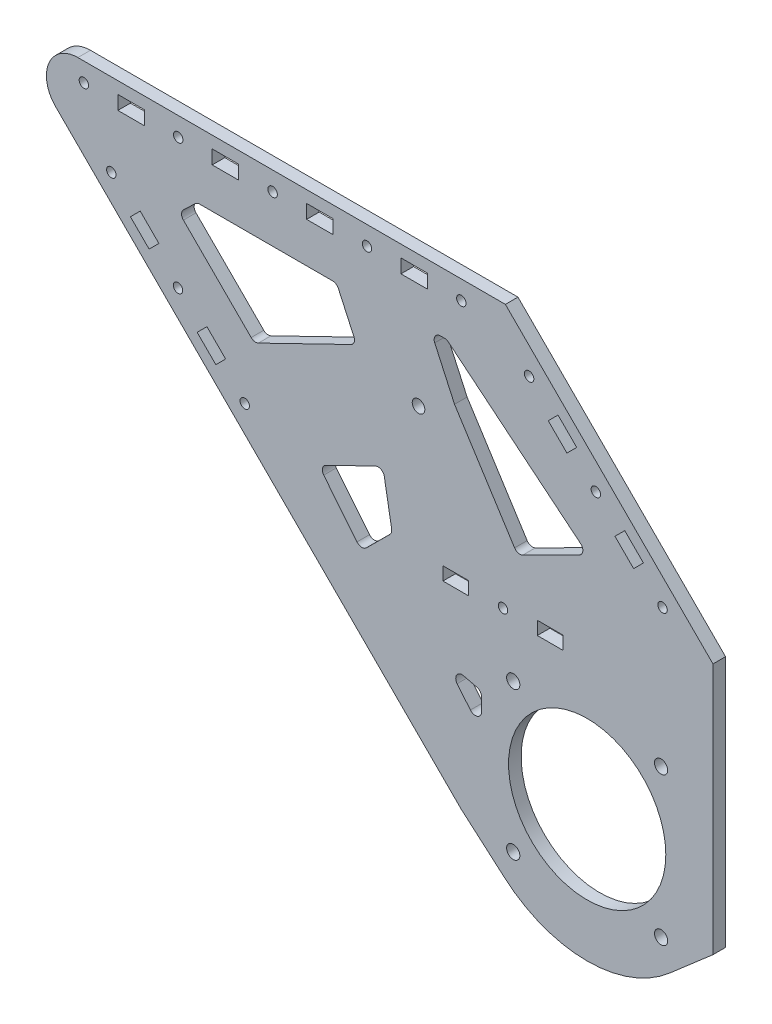
from build123d import *

# Parameters (mm, degrees)
SKETCH_1_R      = 1.5
SKETCH_1_R_2    = 25
SKETCH_1_R_3    = 2
SKETCH_1_R_4    = 2.1
SKETCH_1_W      = 8.4
SKETCH_1_H      = 4.4
SKETCH_1_W_2    = 8.2
SKETCH_1_H_2    = 4.2
EXTRUDE_1_DEPTH = 4
FILLET_2_R      = 2


with BuildPart() as part:
    # 草图1 → 凸台-拉伸1 (new body)
    with BuildSketch(Plane.XY):
        with BuildLine():
            Line((7.027428163, -5.002489357), (20.810808237, -16.960441938))
            ThreePointArc((20.810808237, -16.960441938), (47.017847244, -26.746287876), (73.227648339, -16.967842153))
            Line((73.227648339, -16.967842153), (87.027428163, -5.002489357))
            Line((87.027428163, -5.002489357), (87.027428163, 75.054738201))
            Line((87.027428163, 75.054738201), (21.027428163, 141.054738201))
            Line((21.027428163, 141.054738201), (-114.887663771, 141.054738201))
            ThreePointArc((-114.887663771, 141.054738201), (-124.126459096, 134.881572525), (-121.958731583, 123.983670389))
            Line((-121.958731583, 123.983670389), (-90.203942848, 92.228881654))
            Line((-90.203942848, 92.228881654), (7.027428163, -5.002489357))
        make_face()
        with Locations((-52.972571837, 135.054738201)):
            Circle(SKETCH_1_R, mode=Mode.SUBTRACT)
        with Locations((47.027428163, 15.054738201)):
            Circle(SKETCH_1_R_2, mode=Mode.SUBTRACT)
        with Locations(Location((-22.972571837, 135.054738201, 0), (0, 0, 180))):
            Circle(SKETCH_1_R, mode=Mode.SUBTRACT)
        with Locations((7.027428163, 135.054738201)):
            Circle(SKETCH_1_R, mode=Mode.SUBTRACT)
        with Locations(Location((-112.972571837, 135.054738201, 0), (0, 0, 180))):
            Circle(SKETCH_1_R, mode=Mode.SUBTRACT)
        with Locations((-82.972571837, 135.054738201)):
            Circle(SKETCH_1_R, mode=Mode.SUBTRACT)
        with Locations((49.784787476, 103.812097514)):
            Circle(SKETCH_1_R, mode=Mode.SUBTRACT)
        with Locations(Location((70.997990912, 82.598894078, 0), (0, 0, 180))):
            Circle(SKETCH_1_R, mode=Mode.SUBTRACT)
        with Locations(Location((28.571584041, 125.025300949, 0), (0, 0, 180))):
            Circle(SKETCH_1_R, mode=Mode.SUBTRACT)
        with Locations((-83.04451802, 93.554738201)):
            Circle(SKETCH_1_R, mode=Mode.SUBTRACT)
        with Locations((-61.831314585, 72.341534765)):
            Circle(SKETCH_1_R, mode=Mode.SUBTRACT)
        with Locations(Location((-104.257721456, 114.767941637, 0), (0, 0, 180))):
            Circle(SKETCH_1_R, mode=Mode.SUBTRACT)
        with Locations((20.275835807, 57.054738201)):
            Circle(SKETCH_1_R, mode=Mode.SUBTRACT)
        with Locations((-6.58531727, 99.226748532)):
            Circle(SKETCH_1_R_3, mode=Mode.SUBTRACT)
        with Locations((70.527428163, -8.445261799)):
            Circle(SKETCH_1_R_4, mode=Mode.SUBTRACT)
        with Locations((23.527428163, -8.445261799)):
            Circle(SKETCH_1_R_4, mode=Mode.SUBTRACT)
        with Locations((23.527428163, 38.554738201)):
            Circle(SKETCH_1_R_4, mode=Mode.SUBTRACT)
        with Locations((70.527428163, 38.554738201)):
            Circle(SKETCH_1_R_4, mode=Mode.SUBTRACT)
        with Locations((-37.972571837, 135.054738201)):
            Rectangle(SKETCH_1_W, SKETCH_1_H, mode=Mode.SUBTRACT)
        with Locations((-7.972571837, 135.054738201)):
            Rectangle(SKETCH_1_W, SKETCH_1_H, mode=Mode.SUBTRACT)
        with Locations((-97.972571837, 135.054738201)):
            Rectangle(SKETCH_1_W, SKETCH_1_H, mode=Mode.SUBTRACT)
        with Locations((-67.972571837, 135.054738201)):
            Rectangle(SKETCH_1_W, SKETCH_1_H, mode=Mode.SUBTRACT)
        Polygon((55.865905794, 94.619709358), (61.805602756, 88.680012396), (64.916872594, 91.791282234), (58.977175632, 97.730979196), align=None, mode=Mode.SUBTRACT)
        Polygon((34.652702359, 115.832912794), (37.763972196, 118.944182631), (43.703669158, 113.004485669), (40.592399321, 109.893215832), align=None, mode=Mode.SUBTRACT)
        Polygon((-73.852129865, 87.473619883), (-76.963399702, 84.362350046), (-71.02370274, 78.422653084), (-67.912432903, 81.533922921), align=None, mode=Mode.SUBTRACT)
        Polygon((-89.125636339, 102.747126356), (-92.236906176, 99.635856519), (-98.176603138, 105.575553481), (-95.065333301, 108.686823318), align=None, mode=Mode.SUBTRACT)
        with Locations((5.275835807, 57.054738201)):
            Rectangle(SKETCH_1_W_2, SKETCH_1_H_2, mode=Mode.SUBTRACT)
        with Locations((35.275835807, 57.054738201)):
            Rectangle(SKETCH_1_W_2, SKETCH_1_H_2, mode=Mode.SUBTRACT)
        Polygon((-26.317798475, 106.3059132), (-58.783300448, 90.506724064), (-82.786741677, 114.510165293), (-76.96930946, 120.054738201), (-32.606331473, 120.054738201), align=None, mode=Mode.SUBTRACT)
        Polygon((47.299715686, 85.219705889), (24.926194473, 73.952189511), (4.862626833, 105.451990707), (-2.731253041, 122.054738201), (2.378929733, 122.054738201), align=None, mode=Mode.SUBTRACT)
        Polygon((-14.951358462, 60.079755544), (-17.922436994, 77.027703634), (-38.307901947, 67.107209668), (-24.754047946, 50.34609696), align=None, mode=Mode.SUBTRACT)
        Polygon((1.911503385, 33.57176286), (13.457428163, 19.475351063), (13.457428163, 30.764673398), align=None, mode=Mode.SUBTRACT)
    extrude(amount=EXTRUDE_1_DEPTH)

    # 圆角2
    fillet_2_edges = [part.edges().sort_by_distance(p)[0] for p in [
        (-26.317798475, 106.3059132, 2),
        (-32.606331473, 120.054738201, 2),
        (-76.96930946, 120.054738201, 2),
        (-82.786741677, 114.510165293, 2),
        (-58.783300448, 90.506724064, 2),
        (47.299715686, 85.219705889, 2),
        (2.378929733, 122.054738201, 2),
        (-2.731253041, 122.054738201, 2),
        (24.926194473, 73.952189511, 2),
        (-24.754047946, 50.34609696, 2),
        (-14.951358462, 60.079755544, 2),
        (-17.922436994, 77.027703634, 2),
        (-38.307901947, 67.107209668, 2),
        (13.457428163, 30.764673398, 2),
        (1.911503385, 33.57176286, 2),
        (13.457428163, 19.475351063, 2),
    ]]
    fillet(fillet_2_edges, radius=FILLET_2_R)


solid = part.part
